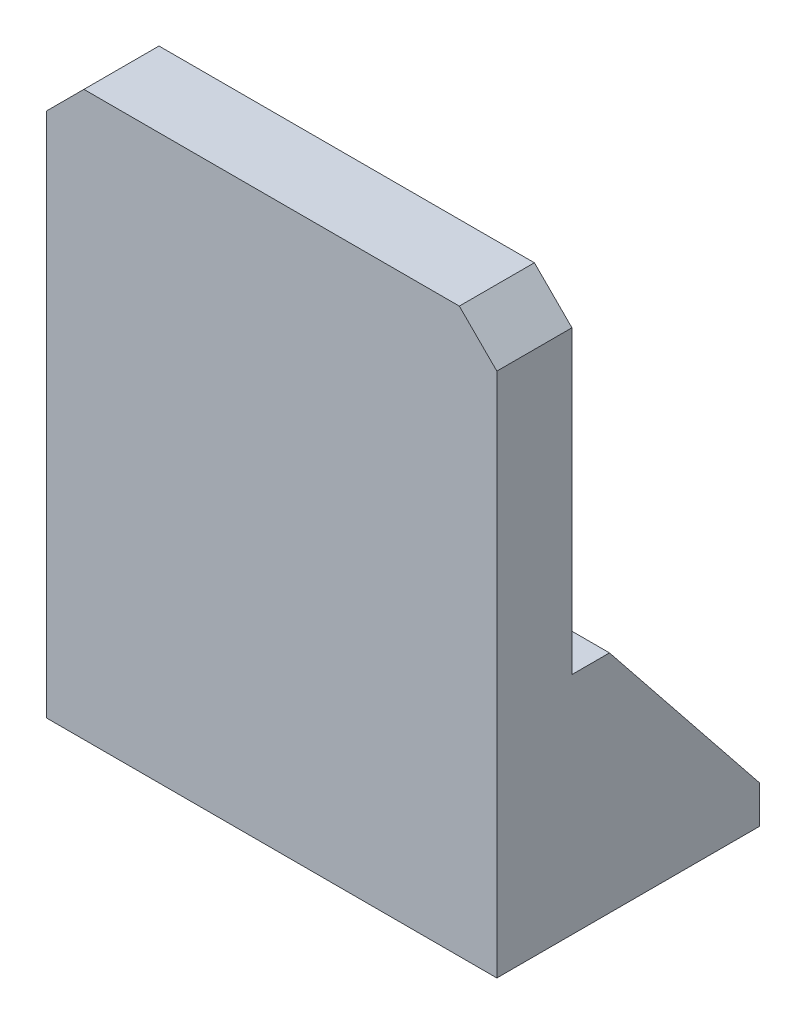
from build123d import *

# Parameters (mm, degrees)
SKETCH_1_W      = 120
SKETCH_1_H      = 150
EXTRUDE_1_DEPTH = 10
CHAMFER_1_SIZE  = 10
EXTRUDE_2_DEPTH = 20


with BuildPart() as part:
    # 草图1 → 凸台-拉伸1 (new, symmetric)
    with BuildSketch(Plane.XY):
        Rectangle(SKETCH_1_W, SKETCH_1_H)
    extrude(amount=EXTRUDE_1_DEPTH, both=True)

    # 倒角1
    chamfer_1_edges = [part.edges().sort_by_distance(p)[0] for p in [
        (-60, 75, 0),
        (60, 75, 0),
    ]]
    chamfer(chamfer_1_edges, length=CHAMFER_1_SIZE)

    # 草图2 → 凸台-拉伸2 (add)
    with BuildSketch(Plane(origin=(60, 0, 0), x_dir=(0, 0, -1), z_dir=(1, 0, 0))):
        Polygon((10, -75), (60, -75), (60, -65), (20, -15), (10, -15), align=None)
    extrude_2 = extrude(amount=-EXTRUDE_2_DEPTH)

    # 镜向1: 凸台-拉伸2 across plane
    add(extrude_2.mirror(Plane(origin=(0, 0, 0), x_dir=(0, 0, 1), z_dir=(1, 0, 0))))


solid = part.part
